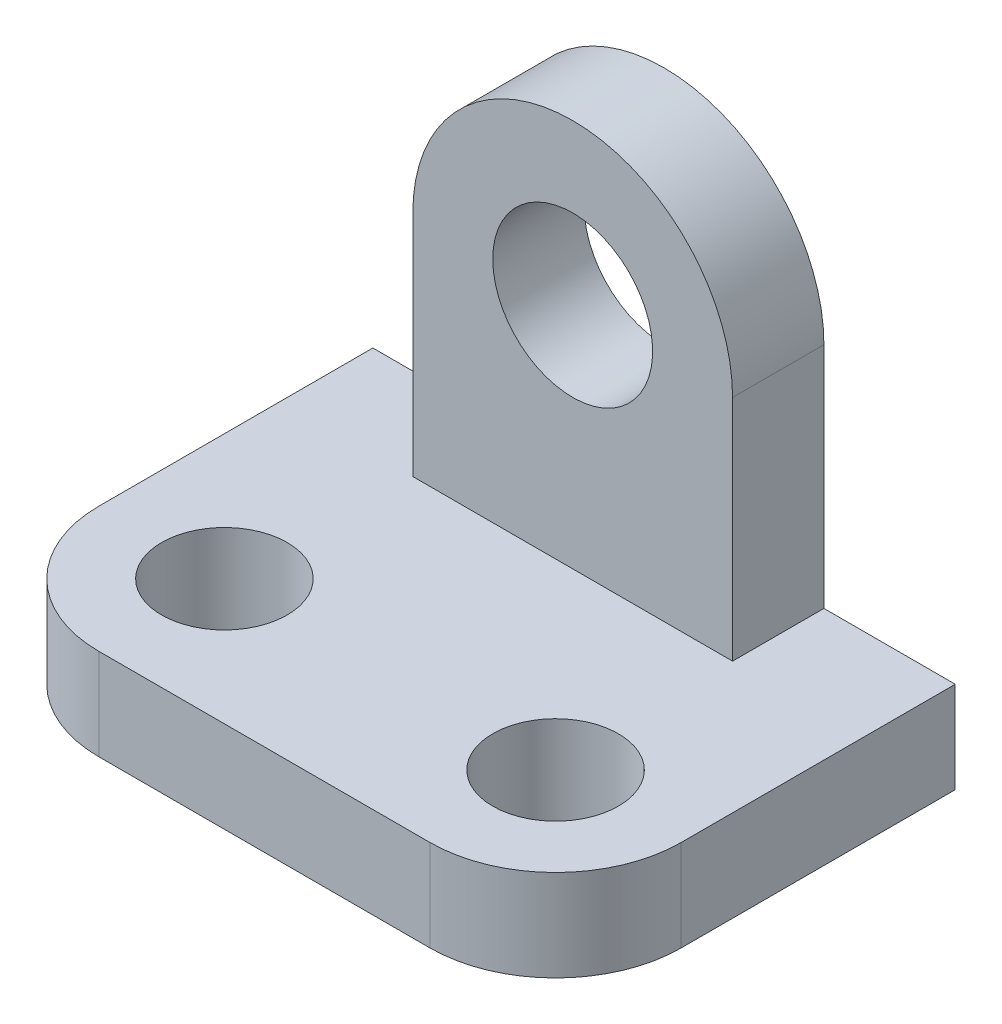
from build123d import *

# Parameters (mm, degrees)
SKETCH_1_R      = 5.5
EXTRUDE_1_DEPTH = 8
SKETCH_2_R      = 7
EXTRUDE_2_DEPTH = 8


with BuildPart() as part:
    # 草图1 → 凸台-拉伸1 (new body)
    with BuildSketch(Plane(origin=(0, 0, 0), x_dir=(1, 0, 0), z_dir=(0, 1, 0))):
        with BuildLine():
            Line((-14.5, -17.5), (14.5, -17.5))
            ThreePointArc((14.5, -17.5), (22.278174593, -14.278174593), (25.5, -6.5))
            Line((25.5, -6.5), (25.5, 17.5))
            Line((25.5, 17.5), (-25.5, 17.5))
            Line((-25.5, 17.5), (-25.5, -6.5))
            ThreePointArc((-25.5, -6.5), (-22.278174593, -14.278174593), (-14.5, -17.5))
        make_face()
        with Locations(Location((14.5, -6.5, 0), (0, 0, 270))):
            Circle(SKETCH_1_R, mode=Mode.SUBTRACT)
        with Locations(Location((-14.5, -6.5, 0), (0, 0, 90))):
            Circle(SKETCH_1_R, mode=Mode.SUBTRACT)
    extrude(amount=EXTRUDE_1_DEPTH)

    # 草图2 → 凸台-拉伸2 (add)
    with BuildSketch(Plane(origin=(0, 0, -17.5), x_dir=(-1, 0, 0), z_dir=(0, 0, -1))):
        with BuildLine():
            Line((-14, 8), (14, 8))
            Line((14, 8), (14, 28))
            ThreePointArc((14, 28), (0, 42), (-14, 28))
            Line((-14, 28), (-14, 8))
        make_face()
        with Locations((0, 28)):
            Circle(SKETCH_2_R, mode=Mode.SUBTRACT)
    extrude(amount=-EXTRUDE_2_DEPTH)


solid = part.part
